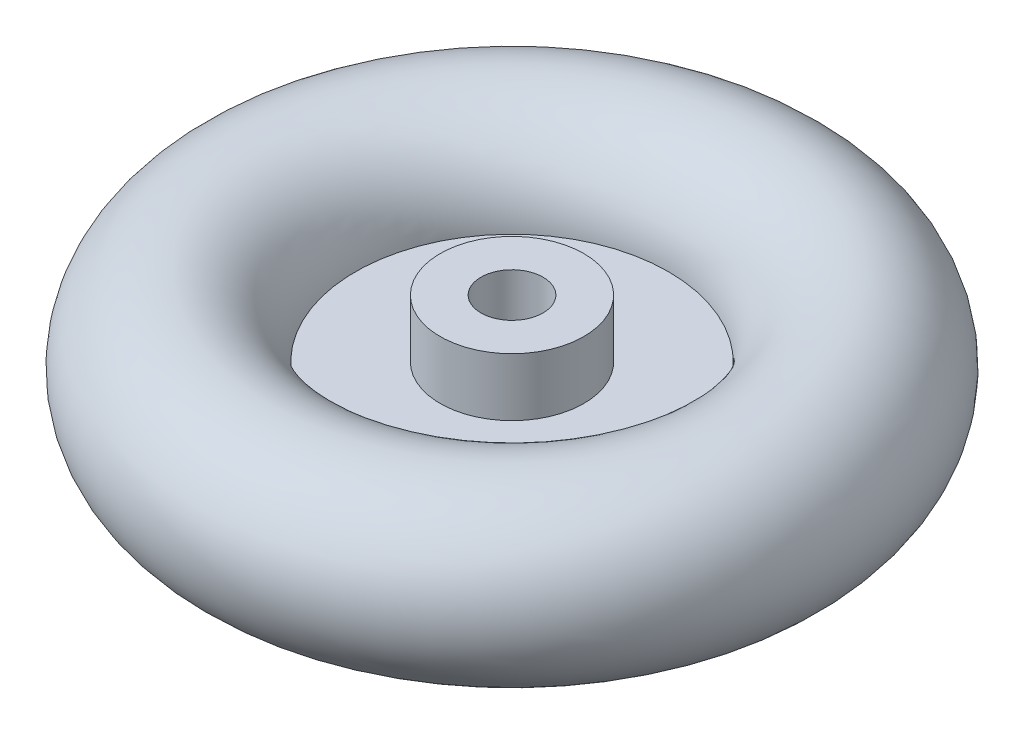
from build123d import *


with BuildPart() as part:
    # 草图1 → 旋转2 (revolve)
    with BuildSketch(Plane.XY, mode=Mode.PRIVATE) as revolve_2_sk:
        with BuildLine():
            Line((15.619751756, 46), (15.619751756, 28.249450756))
            Line((15.619751756, 28.249450756), (41.514974563, 28.249450756))
            ThreePointArc((41.514974563, 28.249450756), (94.514974563, 26.92343472), (41.514974563, 25.597418683))
            Line((41.514974563, 25.597418683), (15.619751756, 25.597418683))
            Line((15.619751756, 25.597418683), (15.619751756, 0))
            Line((15.619751756, 0), (3.119751756, 0))
            Line((3.119751756, 0), (3.119751756, 46))
            Line((3.119751756, 46), (15.619751756, 46))
        make_face()
    revolve(revolve_2_sk.sketch.rotate(Axis((-6.380248244, 0.539107049, 0), (0, 1, 0)), 90), axis=Axis((-6.380248244, 0.539107049, 0), (0, 1, 0)))


solid = part.part
